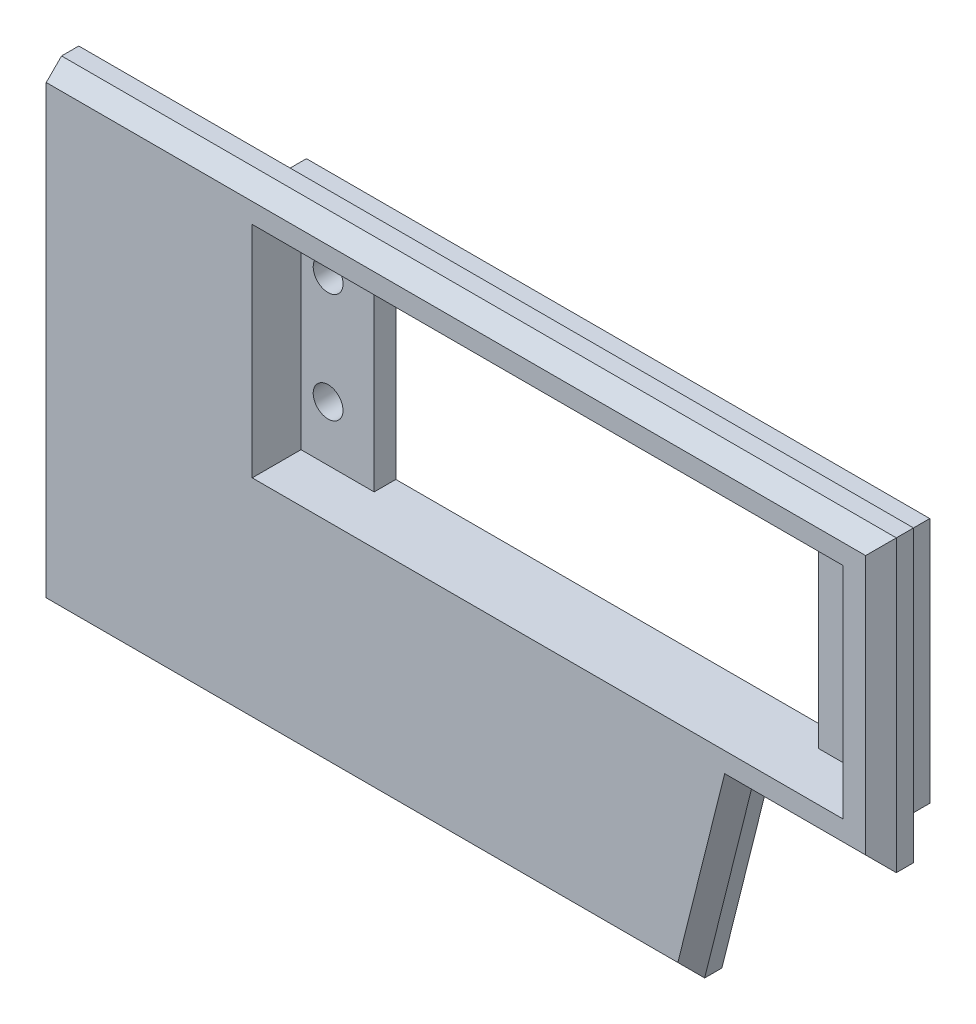
from build123d import *

# Parameters (mm, degrees)
BOSS_EXTRUDE1_DEPTH = 3
CUT_EXTRUDE1_REACH  = 82.709
CUT_EXTRUDE2_REACH  = 82.709
CUT_EXTRUDE3_DEPTH  = 49.851933985
CUT_EXTRUDE4_REACH  = 63.973
SKETCH9_W           = 57.5
SKETCH9_H           = 22.75
BOSS_EXTRUDE2_DEPTH = 3.5
SKETCH13_W          = 54.5
SKETCH13_H          = 20.25
CUT_EXTRUDE6_DEPTH  = 4.5
SKETCH14_W          = 41
SKETCH14_H          = 20.25
CUT_EXTRUDE7_DEPTH  = 2
CUT_EXTRUDE8_REACH  = 49.521
SKETCH15_R          = 1.375
SKETCH16_W          = 17.807241949
SKETCH16_H          = 3
CUT_EXTRUDE9_DEPTH  = 1.5


with BuildPart() as part:
    # Sketch4 → Boss-Extrude1 (new body)
    with BuildSketch(Plane.XY):
        Polygon((22.874373936, -2.75), (36.232991843, -2.75), (36.232991843, 24), (-40.767008157, 24), (-40.767008157, -20), (18.555957827, -20), align=None)
    extrude(amount=BOSS_EXTRUDE1_DEPTH)

    # Sketch5 → Cut-Extrude1 (cut, up to next)
    with BuildSketch(Plane(origin=(36.232991843, 0, 0), x_dir=(0, 0, -1), z_dir=(1, 0, 0)), mode=Mode.PRIVATE) as cut_extrude1_sk1:
        Polygon((-3, 22.585786438), (-1.585786438, 24), (-3, 24), align=None)
    cut_extrude1_tool1 = extrude(cut_extrude1_sk1.sketch, amount=-CUT_EXTRUDE1_REACH, mode=Mode.PRIVATE) & part.part
    # Sketch5 → Cut-Extrude1 (cut, up to next)
    with BuildSketch(Plane(origin=(36.232991843, 0, 0), x_dir=(0, 0, -1), z_dir=(1, 0, 0)), mode=Mode.PRIVATE) as cut_extrude1_sk2:
        Polygon((-3, -18.585786438), (-1.585786438, -20), (-3, -20), align=None)
    cut_extrude1_tool2 = extrude(cut_extrude1_sk2.sketch, amount=-CUT_EXTRUDE1_REACH, mode=Mode.PRIVATE) & part.part
    add(cut_extrude1_tool1.solids().sort_by_distance((36.232992, 23.528595, 2.528595))[0], mode=Mode.SUBTRACT)
    add(cut_extrude1_tool2.solids().sort_by_distance((36.232992, -19.528595, 2.528595))[0], mode=Mode.SUBTRACT)

    # Cut-Extrude2: up to this plane
    cut_extrude2_end = Plane(origin=(18.555957827, -20, 3), z_dir=(-0.9700641682071632, 0.24284873802543147, 0))
    # Sketch5<4> → Cut-Extrude2 (cut, up to the surface)
    with BuildSketch(Plane(origin=(36.232991843, 0, 0), x_dir=(0, 0, -1), z_dir=(1, 0, 0)), mode=Mode.PRIVATE) as cut_extrude2_sk1:
        Polygon((-1.585786438, -2.75), (-3, -1.335786438), (-3, -2.75), align=None)
    cut_extrude2_tool1 = split(extrude(cut_extrude2_sk1.sketch, amount=-CUT_EXTRUDE2_REACH, mode=Mode.PRIVATE), bisect_by=cut_extrude2_end, keep=Keep.BOTH, mode=Mode.PRIVATE)
    add(cut_extrude2_tool1.solids().sort_by_distance((36.232992, -2.278595, 2.528595))[0], mode=Mode.SUBTRACT)

    # Sketch7 → Cut-Extrude3 (cut, through all)
    with BuildSketch(Plane.XZ.offset(2.75)):
        Polygon((36.232991843, 1.585786438), (34.818778281, 3), (36.232991843, 3), align=None)
    extrude(amount=-CUT_EXTRUDE3_DEPTH, mode=Mode.SUBTRACT)

    # Cut-Extrude4: up to this plane
    cut_extrude4_end = Plane(origin=(21.020533502, -2.167893219, 2.167893219), z_dir=(0, 0.7071067811865472, -0.707106781186548))
    # Sketch8 → Cut-Extrude4 (cut, up to the surface)
    with BuildSketch(Plane.XZ.offset(20), mode=Mode.PRIVATE) as cut_extrude4_sk1:
        Polygon((17.141744264, 3), (18.555957827, 3), (18.555957827, 1.585786438), align=None)
    cut_extrude4_tool1 = split(extrude(cut_extrude4_sk1.sketch, amount=CUT_EXTRUDE4_REACH, dir=(0.242848738025, 0.970064168207, 0), mode=Mode.PRIVATE), bisect_by=cut_extrude4_end, keep=Keep.BOTH, mode=Mode.PRIVATE)
    add(cut_extrude4_tool1.solids().sort_by_distance((18.084553, -20, 2.528595))[0], mode=Mode.SUBTRACT)

    # Sketch9 → Boss-Extrude2 (add)
    with BuildSketch(Plane.XY):
        with Locations((5.482991843, 10.625)):
            Rectangle(SKETCH9_W, SKETCH9_H)
    extrude(amount=-BOSS_EXTRUDE2_DEPTH)

    # Sketch13 → Cut-Extrude6 (cut)
    with BuildSketch(Plane.XY.offset(3)):
        with Locations((5.482991843, 10.625)):
            Rectangle(SKETCH13_W, SKETCH13_H)
    extrude(amount=-CUT_EXTRUDE6_DEPTH, mode=Mode.SUBTRACT)

    # Sketch14 → Cut-Extrude7 (cut)
    with BuildSketch(Plane.XY.offset(-1.5)):
        with Locations((5.482991843, 10.625)):
            Rectangle(SKETCH14_W, SKETCH14_H)
    extrude(amount=-CUT_EXTRUDE7_DEPTH, mode=Mode.SUBTRACT)

    # Sketch15 → Cut-Extrude8 (cut, up to next)
    with BuildSketch(Plane.XY.offset(-1.5), mode=Mode.PRIVATE) as cut_extrude8_sk1:
        with Locations((30.232991843, 15.675)):
            Circle(SKETCH15_R)
    cut_extrude8_tool1 = extrude(cut_extrude8_sk1.sketch, amount=-CUT_EXTRUDE8_REACH, mode=Mode.PRIVATE) & part.part
    # Sketch15 → Cut-Extrude8 (cut, up to next)
    with BuildSketch(Plane.XY.offset(-1.5), mode=Mode.PRIVATE) as cut_extrude8_sk2:
        with Locations(Location((30.232991843, 5.575, 0), (0, 0, 180))):
            Circle(SKETCH15_R)
    cut_extrude8_tool2 = extrude(cut_extrude8_sk2.sketch, amount=-CUT_EXTRUDE8_REACH, mode=Mode.PRIVATE) & part.part
    # Sketch15 → Cut-Extrude8 (cut, up to next)
    with BuildSketch(Plane.XY.offset(-1.5), mode=Mode.PRIVATE) as cut_extrude8_sk3:
        with Locations((-19.267008157, 5.575)):
            Circle(SKETCH15_R)
    cut_extrude8_tool3 = extrude(cut_extrude8_sk3.sketch, amount=-CUT_EXTRUDE8_REACH, mode=Mode.PRIVATE) & part.part
    # Sketch15 → Cut-Extrude8 (cut, up to next)
    with BuildSketch(Plane.XY.offset(-1.5), mode=Mode.PRIVATE) as cut_extrude8_sk4:
        with Locations(Location((-19.267008157, 15.675, 0), (0, 0, 180))):
            Circle(SKETCH15_R)
    cut_extrude8_tool4 = extrude(cut_extrude8_sk4.sketch, amount=-CUT_EXTRUDE8_REACH, mode=Mode.PRIVATE) & part.part
    add(cut_extrude8_tool1.solids().sort_by_distance((30.232992, 15.675, -1.5))[0], mode=Mode.SUBTRACT)
    add(cut_extrude8_tool2.solids().sort_by_distance((30.232992, 5.575, -1.5))[0], mode=Mode.SUBTRACT)
    add(cut_extrude8_tool3.solids().sort_by_distance((-19.267008, 5.575, -1.5))[0], mode=Mode.SUBTRACT)
    add(cut_extrude8_tool4.solids().sort_by_distance((-19.267008, 15.675, -1.5))[0], mode=Mode.SUBTRACT)

    # Sketch16 → Cut-Extrude9 (cut)
    with BuildSketch(Plane(origin=(0, 0, 0), x_dir=(-1, 0, 0), z_dir=(0, 0, -1))):
        with Locations((31.863387182, -5.5)):
            Rectangle(SKETCH16_W, SKETCH16_H)
    extrude(amount=-CUT_EXTRUDE9_DEPTH, mode=Mode.SUBTRACT)


solid = part.part
